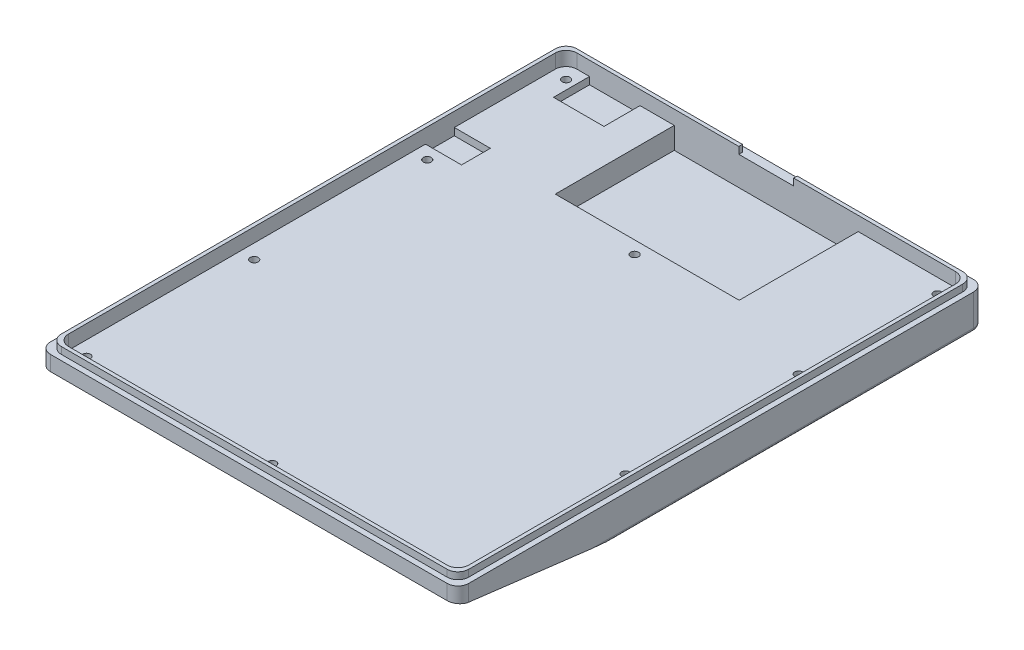
from build123d import *

# Parameters (mm, degrees)
SKETCH_1_W           = 116
SKETCH_1_H           = 146
EXTRUDE_1_DEPTH      = 30
SKETCH_2_R           = 1.1
CUT_EXTRUDE_3_DEPTH  = 189.870325885
SKETCH_5_W           = 110
SKETCH_5_H           = 140
CUT_EXTRUDE_4_DEPTH  = 4
CUT_EXTRUDE_5_DEPTH  = 189.870325885
SKETCH_9_W           = 51
SKETCH_9_H           = 32.5
CUT_EXTRUDE_7_DEPTH  = 6
SKETCH_13_W          = 111
SKETCH_13_H          = 141
CUT_EXTRUDE_11_DEPTH = 4
SKETCH_15_W          = 51
SKETCH_15_H          = 0.5
CUT_EXTRUDE_12_DEPTH = 6
SKETCH_16_W          = 116
SKETCH_16_H          = 146
SKETCH_16_W_2        = 113
SKETCH_16_H_2        = 143
CUT_EXTRUDE_13_DEPTH = 2
SKETCH_17_W          = 14
SKETCH_17_H          = 10
SKETCH_17_W_2        = 10
SKETCH_17_H_2        = 8
CUT_EXTRUDE_14_DEPTH = 2
SKETCH_18_W          = 113
SKETCH_18_H          = 143
CUT_EXTRUDE_15_DEPTH = 0.1
SKETCH_19_W          = 14.8
SKETCH_19_H          = 2
CUT_EXTRUDE_17_DEPTH = 1.5
SKETCH_20_W          = 14.8
SKETCH_20_H          = 1
EXTRUDE_4_DEPTH      = 0.1
SKETCH_21_W          = 15.2
SKETCH_21_H          = 1.9
CUT_EXTRUDE_18_DEPTH = 1
SKETCH_22_R          = 2
CUT_EXTRUDE_19_DEPTH = 188.550218861
SKETCH_23_R          = 2
SKETCH_23_R_2        = 1.1
EXTRUDE_5_DEPTH      = 5.5
SKETCH_24_R          = 2
SKETCH_24_R_2        = 1.1
EXTRUDE_6_DEPTH      = 1.2
SKETCH_26_R          = 4.05
CUT_EXTRUDE_20_DEPTH = 1.5
SKETCH_32_W          = 116
SKETCH_32_H          = 10
EXTRUDE_7_DEPTH      = 10
CUT_EXTRUDE_22_DEPTH = 22.376967
FILLET_16_R          = 3
FILLET_18_R          = 1
FILLET_25_R          = 180
FILLET_26_R          = 180
FILLET_27_R          = 3
CUT_EXTRUDE_23_DEPTH = 1.5


with BuildPart() as part:
    # 스케치1 → 보스-돌출1 (new body)
    with BuildSketch(Plane(origin=(0, 0, 0), x_dir=(1, 0, 0), z_dir=(0, 1, 0))):
        with Locations((58, -73)):
            Rectangle(SKETCH_1_W, SKETCH_1_H)
    extrude(amount=-EXTRUDE_1_DEPTH)

    # 스케치2 → 컷-돌출3 (cut, through all)
    with BuildSketch(Plane(origin=(0, 0, 0), x_dir=(1, 0, 0), z_dir=(0, 1, 0))):
        with Locations(Location((6.5, -139.5, 0), (0, 0, 270))):
            Circle(SKETCH_2_R)
        with Locations(Location((109.5, -139.5, 0), (0, 0, 270))):
            Circle(SKETCH_2_R)
        with Locations(Location((58, -139.5, 0), (0, 0, 270))):
            Circle(SKETCH_2_R)
        with Locations(Location((6.5, -93, 0), (0, 0, 270))):
            Circle(SKETCH_2_R)
        with Locations(Location((109.5, -93, 0), (0, 0, 270))):
            Circle(SKETCH_2_R)
        with Locations(Location((6.5, -45, 0), (0, 0, 270))):
            Circle(SKETCH_2_R)
        with Locations(Location((109.5, -45, 0), (0, 0, 270))):
            Circle(SKETCH_2_R)
        with Locations(Location((58, -39, 0), (0, 0, 270))):
            Circle(SKETCH_2_R)
        with Locations(Location((6.5, -6.5, 0), (0, 0, 270))):
            Circle(SKETCH_2_R)
        with Locations(Location((109.5, -6.5, 0), (0, 0, 270))):
            Circle(SKETCH_2_R)
    extrude(amount=-CUT_EXTRUDE_3_DEPTH, mode=Mode.SUBTRACT)

    # 스케치5 → 컷-돌출4 (cut)
    with BuildSketch(Plane(origin=(0, 0, 0), x_dir=(1, 0, 0), z_dir=(0, 1, 0))):
        with Locations((58, -73)):
            Rectangle(SKETCH_5_W, SKETCH_5_H)
    extrude(amount=-CUT_EXTRUDE_4_DEPTH, mode=Mode.SUBTRACT)

    # 스케치6 → 컷-돌출5 (cut, through all)
    with BuildSketch(Plane(origin=(116, 0, 0), x_dir=(0, 0, -1), z_dir=(1, 0, 0))):
        Polygon((-149.104471467, -5.769239715), (15.481959193, -25.977912334), (15.481959193, -42.516159971), (-150.117483456, -37.174576773), align=None)
    extrude(amount=-CUT_EXTRUDE_5_DEPTH, mode=Mode.SUBTRACT)

    # 스케치9 → 컷-돌출7 (cut)
    with BuildSketch(Plane(origin=(0, -4, 0), x_dir=(1, 0, 0), z_dir=(0, 1, 0))):
        with Locations((58, -19.25)):
            Rectangle(SKETCH_9_W, SKETCH_9_H)
    extrude(amount=-CUT_EXTRUDE_7_DEPTH, mode=Mode.SUBTRACT)

    # 스케치13 → 컷-돌출11 (cut)
    with BuildSketch(Plane(origin=(0, 0, 0), x_dir=(1, 0, 0), z_dir=(0, 1, 0))):
        with Locations((58, -73)):
            Rectangle(SKETCH_13_W, SKETCH_13_H)
    extrude(amount=-CUT_EXTRUDE_11_DEPTH, mode=Mode.SUBTRACT)

    # 스케치15 → 컷-돌출12 (cut)
    with BuildSketch(Plane(origin=(0, -4, 0), x_dir=(1, 0, 0), z_dir=(0, 1, 0))):
        with Locations((58, -2.75)):
            Rectangle(SKETCH_15_W, SKETCH_15_H)
    extrude(amount=-CUT_EXTRUDE_12_DEPTH, mode=Mode.SUBTRACT)

    # 스케치16 → 컷-돌출13 (cut)
    with BuildSketch(Plane(origin=(0, 0, 0), x_dir=(1, 0, 0), z_dir=(0, 1, 0))):
        with Locations((58, -73)):
            Rectangle(SKETCH_16_W, SKETCH_16_H)
        with Locations((58, -73)):
            Rectangle(SKETCH_16_W_2, SKETCH_16_H_2, mode=Mode.SUBTRACT)
    extrude(amount=-CUT_EXTRUDE_13_DEPTH, mode=Mode.SUBTRACT)

    # 스케치17 → 컷-돌출14 (cut)
    with BuildSketch(Plane(origin=(0, -4, 0), x_dir=(1, 0, 0), z_dir=(0, 1, 0))):
        with Locations((16, -7.5)):
            Rectangle(SKETCH_17_W, SKETCH_17_H)
        with Locations((7.5, -37.5)):
            Rectangle(SKETCH_17_W_2, SKETCH_17_H_2)
    extrude(amount=-CUT_EXTRUDE_14_DEPTH, mode=Mode.SUBTRACT)

    # 스케치18 → 컷-돌출15 (cut)
    with BuildSketch(Plane(origin=(0, 0, 0), x_dir=(1, 0, 0), z_dir=(0, 1, 0))):
        with Locations((58, -73)):
            Rectangle(SKETCH_18_W, SKETCH_18_H)
    extrude(amount=-CUT_EXTRUDE_15_DEPTH, mode=Mode.SUBTRACT)

    # 스케치19 → 컷-돌출17 (cut)
    with BuildSketch(Plane(origin=(0, 0, 1.5), x_dir=(-1, 0, 0), z_dir=(0, 0, -1))):
        with Locations((-58, -1.1)):
            Rectangle(SKETCH_19_W, SKETCH_19_H)
    extrude(amount=-CUT_EXTRUDE_17_DEPTH, mode=Mode.SUBTRACT)

    # 스케치20 → 보스-돌출4 (add)
    with BuildSketch(Plane(origin=(0, -2.1, 0), x_dir=(1, 0, 0), z_dir=(0, 1, 0))):
        with Locations((58, -2)):
            Rectangle(SKETCH_20_W, SKETCH_20_H)
    extrude(amount=EXTRUDE_4_DEPTH)

    # 스케치21 → 컷-돌출18 (cut)
    with BuildSketch(Plane(origin=(0, 0, 1.5), x_dir=(-1, 0, 0), z_dir=(0, 0, -1))):
        with Locations((-58, -1.05)):
            Rectangle(SKETCH_21_W, SKETCH_21_H)
    extrude(amount=-CUT_EXTRUDE_18_DEPTH, mode=Mode.SUBTRACT)

    # 스케치22 → 컷-돌출19 (cut, through all)
    with BuildSketch(Plane(origin=(0, -4, 0), x_dir=(1, 0, 0), z_dir=(0, 1, 0))):
        with Locations(Location((6.5, -6.5, 0), (0, 0, 270))):
            Circle(SKETCH_22_R)
        with Locations(Location((109.5, -6.5, 0), (0, 0, 270))):
            Circle(SKETCH_22_R)
        with Locations(Location((109.5, -45, 0), (0, 0, 270))):
            Circle(SKETCH_22_R)
        with Locations(Location((58, -39, 0), (0, 0, 270))):
            Circle(SKETCH_22_R)
        with Locations(Location((6.5, -45, 0), (0, 0, 270))):
            Circle(SKETCH_22_R)
        with Locations(Location((6.5, -93, 0), (0, 0, 270))):
            Circle(SKETCH_22_R)
        with Locations(Location((6.5, -139.5, 0), (0, 0, 270))):
            Circle(SKETCH_22_R)
        with Locations(Location((58, -139.5, 0), (0, 0, 270))):
            Circle(SKETCH_22_R)
        with Locations(Location((109.5, -139.5, 0), (0, 0, 270))):
            Circle(SKETCH_22_R)
        with Locations(Location((109.5, -93, 0), (0, 0, 270))):
            Circle(SKETCH_22_R)
    extrude(amount=-CUT_EXTRUDE_19_DEPTH, mode=Mode.SUBTRACT)

    # 스케치23 → 보스-돌출5 (add)
    # profile 1 of 7: a face of its own
    with BuildSketch(Plane(origin=(0, -4, 0), x_dir=(1, 0, 0), z_dir=(0, 1, 0))):
        with Locations(Location((6.5, -6.5, 0), (0, 0, 270))):
            Circle(SKETCH_23_R)
        with Locations(Location((6.5, -6.5, 0), (0, 0, 270))):
            Circle(SKETCH_23_R_2, mode=Mode.SUBTRACT)
    # profile 2 of 7: a face of its own
    with BuildSketch(Plane(origin=(0, -4, 0), x_dir=(1, 0, 0), z_dir=(0, 1, 0))):
        with Locations(Location((6.5, -45, 0), (0, 0, 270))):
            Circle(SKETCH_23_R)
        with Locations(Location((6.5, -45, 0), (0, 0, 270))):
            Circle(SKETCH_23_R_2, mode=Mode.SUBTRACT)
    # profile 3 of 7: a face of its own
    with BuildSketch(Plane(origin=(0, -4, 0), x_dir=(1, 0, 0), z_dir=(0, 1, 0))):
        with Locations(Location((6.5, -93, 0), (0, 0, 270))):
            Circle(SKETCH_23_R)
        with Locations(Location((6.5, -93, 0), (0, 0, 270))):
            Circle(SKETCH_23_R_2, mode=Mode.SUBTRACT)
    # profile 4 of 7: a face of its own
    with BuildSketch(Plane(origin=(0, -4, 0), x_dir=(1, 0, 0), z_dir=(0, 1, 0))):
        with Locations(Location((109.5, -93, 0), (0, 0, 270))):
            Circle(SKETCH_23_R)
        with Locations(Location((109.5, -93, 0), (0, 0, 270))):
            Circle(SKETCH_23_R_2, mode=Mode.SUBTRACT)
    # profile 5 of 7: a face of its own
    with BuildSketch(Plane(origin=(0, -4, 0), x_dir=(1, 0, 0), z_dir=(0, 1, 0))):
        with Locations(Location((109.5, -45, 0), (0, 0, 270))):
            Circle(SKETCH_23_R)
        with Locations(Location((109.5, -45, 0), (0, 0, 270))):
            Circle(SKETCH_23_R_2, mode=Mode.SUBTRACT)
    # profile 6 of 7: a face of its own
    with BuildSketch(Plane(origin=(0, -4, 0), x_dir=(1, 0, 0), z_dir=(0, 1, 0))):
        with Locations(Location((58, -39, 0), (0, 0, 270))):
            Circle(SKETCH_23_R)
        with Locations(Location((58, -39, 0), (0, 0, 270))):
            Circle(SKETCH_23_R_2, mode=Mode.SUBTRACT)
    # profile 7 of 7: a face of its own
    with BuildSketch(Plane(origin=(0, -4, 0), x_dir=(1, 0, 0), z_dir=(0, 1, 0))):
        with Locations(Location((109.5, -6.5, 0), (0, 0, 270))):
            Circle(SKETCH_23_R)
        with Locations(Location((109.5, -6.5, 0), (0, 0, 270))):
            Circle(SKETCH_23_R_2, mode=Mode.SUBTRACT)
    extrude(amount=-EXTRUDE_5_DEPTH)

    # 스케치24 → 보스-돌출6 (add)
    # profile 1 of 3: a face of its own
    with BuildSketch(Plane(origin=(0, -4, 0), x_dir=(1, 0, 0), z_dir=(0, 1, 0))):
        with Locations(Location((6.5, -139.5, 0), (0, 0, 270))):
            Circle(SKETCH_24_R)
        with Locations(Location((6.5, -139.5, 0), (0, 0, 270))):
            Circle(SKETCH_24_R_2, mode=Mode.SUBTRACT)
    # profile 2 of 3: a face of its own
    with BuildSketch(Plane(origin=(0, -4, 0), x_dir=(1, 0, 0), z_dir=(0, 1, 0))):
        with Locations(Location((58, -139.5, 0), (0, 0, 270))):
            Circle(SKETCH_24_R)
        with Locations(Location((58, -139.5, 0), (0, 0, 270))):
            Circle(SKETCH_24_R_2, mode=Mode.SUBTRACT)
    # profile 3 of 3: a face of its own
    with BuildSketch(Plane(origin=(0, -4, 0), x_dir=(1, 0, 0), z_dir=(0, 1, 0))):
        with Locations(Location((109.5, -139.5, 0), (0, 0, 270))):
            Circle(SKETCH_24_R)
        with Locations(Location((109.5, -139.5, 0), (0, 0, 270))):
            Circle(SKETCH_24_R_2, mode=Mode.SUBTRACT)
    extrude(amount=-EXTRUDE_6_DEPTH)

    # 스케치26 → 컷-돌출20 (cut)
    with BuildSketch(Plane(origin=(0, -23.719372367, 2.912372721), x_dir=(1, 0, 0), z_dir=(0, -0.992546151641323, 0.12186934340514062))):
        with Locations(Location((12, 9.065755868, 0), (0, 0, 270))):
            Circle(SKETCH_26_R)
        with BuildLine():
            ThreePointArc((108.05, 9.065755868), (101.136217536, 11.929538332), (104, 5.015755868))
            Line((104, 5.015755868), (104, 9.065755868))
            Line((104, 9.065755868), (108.05, 9.065755868))
        make_face()
        with BuildLine():
            Line((104, 9.065755868), (104, 5.015755868))
            ThreePointArc((104, 5.015755868), (106.863782464, 6.201973404), (108.05, 9.065755868))
            Line((108.05, 9.065755868), (104, 9.065755868))
        make_face()
        with BuildLine():
            ThreePointArc((16.05, 132.162190385), (14.863782464, 135.025972849), (12, 136.212190385))
            Line((12, 136.212190385), (12, 132.162190385))
            Line((12, 132.162190385), (7.95, 132.162190385))
            ThreePointArc((7.95, 132.162190385), (12, 128.112190385), (16.05, 132.162190385))
        make_face()
        with BuildLine():
            Line((12, 132.162190385), (12, 136.212190385))
            ThreePointArc((12, 136.212190385), (9.136217536, 135.025972849), (7.95, 132.162190385))
            Line((7.95, 132.162190385), (12, 132.162190385))
        make_face()
        with Locations(Location((104, 132.162190385, 0), (0, 0, 270))):
            Circle(SKETCH_26_R)
    extrude(amount=-CUT_EXTRUDE_20_DEPTH, mode=Mode.SUBTRACT)


with BuildPart() as body_2:
    # 스케치32 → 보스-돌출7 (new body)
    with BuildSketch(Plane(origin=(0, 0, 0), x_dir=(-1, 0, 0), z_dir=(0, 0, -1))):
        with Locations((-58, -29.076966773)):
            Rectangle(SKETCH_32_W, SKETCH_32_H)
    extrude(amount=EXTRUDE_7_DEPTH)


with BuildPart() as cut_extrude_22_tool:
    # 스케치33 → 컷-돌출22 (new body)
    with BuildSketch(Plane.XZ.offset(34.076966773)):
        Polygon((0, 126), (0, 0), (18, 0), (18, 66), align=None)
        Polygon((18, 0), (0, 0), (0, -10), (116, -10), (116, 0), (98, 0), align=None)
        Polygon((98, 66), (98, 0), (116, 0), (116, 126), align=None)
    extrude(amount=-CUT_EXTRUDE_22_DEPTH)


with BuildPart() as part_1:
    add(part.part)

    # 컷-돌출22: cut by cut_extrude_22_tool
    add(cut_extrude_22_tool.part, mode=Mode.SUBTRACT)

    # 필렛16
    fillet_16_edges = [part_1.edges().sort_by_distance(p)[0] for p in [
        (0, -4.07521044, 146),
        (116, -4.07521044, 146),
        (2.5, -2.05, 2.5),
        (113.5, -2.05, 2.5),
        (113.5, -2.05, 143.5),
        (2.5, -2.05, 143.5),
        (114.5, -1.05, 1.5),
        (114.5, -1.05, 144.5),
        (1.5, -1.05, 144.5),
        (1.5, -1.05, 1.5),
        (116, -6.849999886, 0),
        (0, -6.849999886, 0),
    ]]
    fillet(fillet_16_edges, radius=FILLET_16_R)

    # 필렛18
    fillet_18_edges = [part_1.edges().sort_by_distance(p)[0] for p in [
        (10.5, -11.699999773, 0),
        (0, -11.699999773, 51.901153488),
        (116, -11.699999773, 51.901153488),
        (105.5, -11.699999773, 0),
        (115.121320344, -11.699999773, 0.878679656),
        (0.878679656, -11.699999773, 0.878679656),
    ]]
    fillet(fillet_18_edges, radius=FILLET_18_R)

    # 필렛25
    fillet_25_edges = [part_1.edges().sort_by_distance(p)[0] for p in [
        (98, -13.836592763, 66),
    ]]
    fillet(fillet_25_edges, radius=FILLET_25_R)

    # 필렛26
    fillet_26_edges = [part_1.edges().sort_by_distance(p)[0] for p in [
        (18, -13.836592763, 66),
    ]]
    fillet(fillet_26_edges, radius=FILLET_26_R)

    # 필렛27
    fillet_27_edges = [part_1.edges().sort_by_distance(p)[0] for p in [
        (18, -17.388483273, 0),
        (98, -17.388483273, 0),
    ]]
    fillet(fillet_27_edges, radius=FILLET_27_R)

    # 스케치34 → 컷-돌출23 (cut)
    with BuildSketch(Plane(origin=(0, -23.719372367, 2.912372721), x_dir=(1, 0, 0), z_dir=(0, -0.992546151641323, 0.12186934340514062))):
        with BuildLine():
            ThreePointArc((23.95, 7.065755868), (25.136217536, 4.201973404), (28, 3.015755868))
            Line((28, 3.015755868), (28, 7.065755868))
            Line((28, 7.065755868), (23.95, 7.065755868))
        make_face()
        with BuildLine():
            Line((28, 7.065755868), (28, 3.015755868))
            ThreePointArc((28, 3.015755868), (30.863782464, 4.201973404), (32.05, 7.065755868))
            ThreePointArc((32.05, 7.065755868), (28, 11.115755868), (23.95, 7.065755868))
            Line((23.95, 7.065755868), (28, 7.065755868))
        make_face()
        with BuildLine():
            ThreePointArc((88, 3.015755868), (90.863782464, 4.201973404), (92.05, 7.065755868))
            Line((92.05, 7.065755868), (88, 7.065755868))
            Line((88, 7.065755868), (88, 3.015755868))
        make_face()
        with BuildLine():
            Line((88, 7.065755868), (92.05, 7.065755868))
            ThreePointArc((92.05, 7.065755868), (85.136217536, 9.929538332), (88, 3.015755868))
            Line((88, 3.015755868), (88, 7.065755868))
        make_face()
    extrude(amount=-CUT_EXTRUDE_23_DEPTH, mode=Mode.SUBTRACT)


with BuildPart() as body_2_1:
    add(body_2.part)

    # 컷-돌출22: cut by cut_extrude_22_tool
    add(cut_extrude_22_tool.part, mode=Mode.SUBTRACT)


solid = part_1.part
